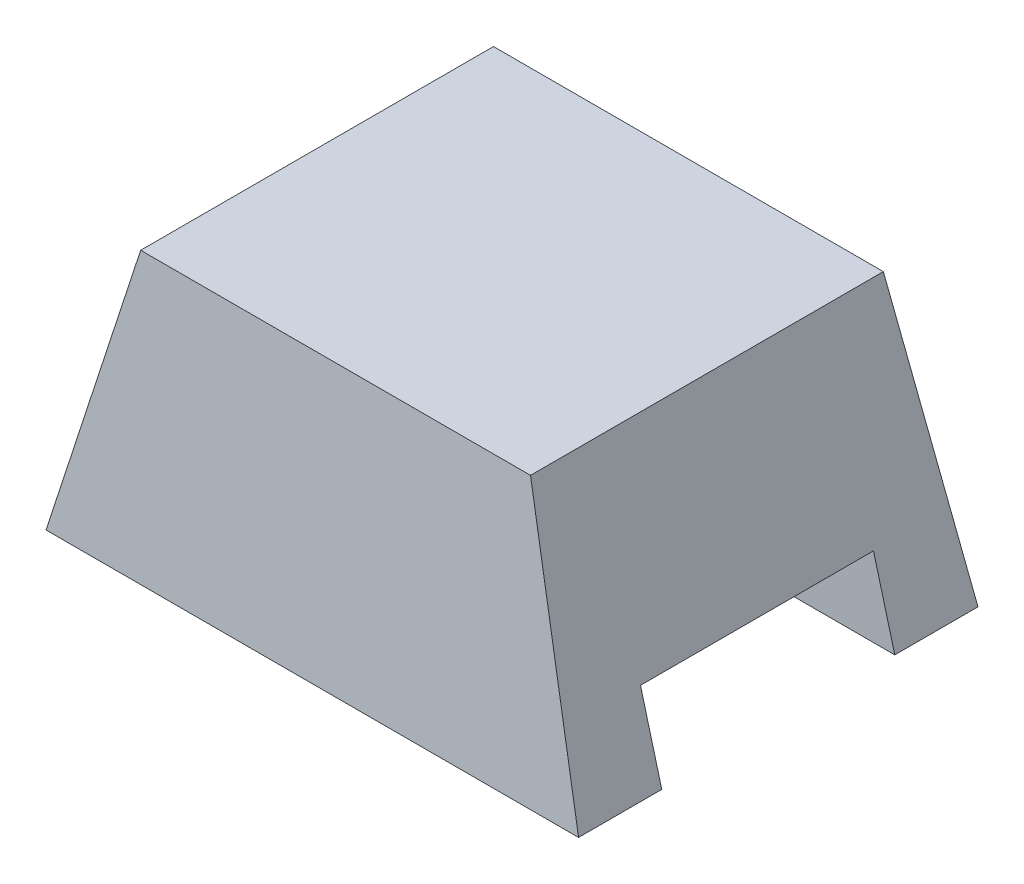
from build123d import *

# Parameters (mm, degrees)
SKETCH_5_W          = 80
SKETCH_5_H          = 40
EXTRUDE_3_DEPTH     = 60
DRAFT_6_ANGLE       = -15
DRAFT_7_ANGLE       = -5
SKETCH_8_W          = 35
SKETCH_8_H          = 31.411047216
CUT_EXTRUDE_1_DEPTH = 117


with BuildPart() as part:
    # 스케치5 → 보스-돌출3 (new body)
    with BuildSketch(Plane.XY):
        with Locations((40, 20)):
            Rectangle(SKETCH_5_W, SKETCH_5_H)
    extrude(amount=EXTRUDE_3_DEPTH)

    # 구배6
    draft_6_faces = [part.faces().sort_by_distance(p)[0] for p in [
        (80, 20, 30),
        (0, 20, 30),
    ]]
    draft(draft_6_faces, Plane(origin=(0, 0, 60), x_dir=(0, 0, -1), z_dir=(0, -1, 0)), DRAFT_6_ANGLE)

    # 구배7
    draft_7_faces = [part.faces().sort_by_distance(p)[0] for p in [
        (40, 18.968663077, 0),
        (40, 18.968663077, 60),
    ]]
    draft(draft_7_faces, Plane(origin=(0, 0, 60), x_dir=(0, 0, -1), z_dir=(0, -1, 0)), DRAFT_7_ANGLE)

    # 스케치8 → 컷-돌출1 (cut)
    with BuildSketch(Plane(origin=(0, 0, 0), x_dir=(0, 0, 1), z_dir=(-0.9659258262890682, 0.25881904510252135, 0))):
        with Locations((30, 15.705523608)):
            Rectangle(SKETCH_8_W, SKETCH_8_H)
    extrude(amount=-CUT_EXTRUDE_1_DEPTH, mode=Mode.SUBTRACT)


solid = part.part
